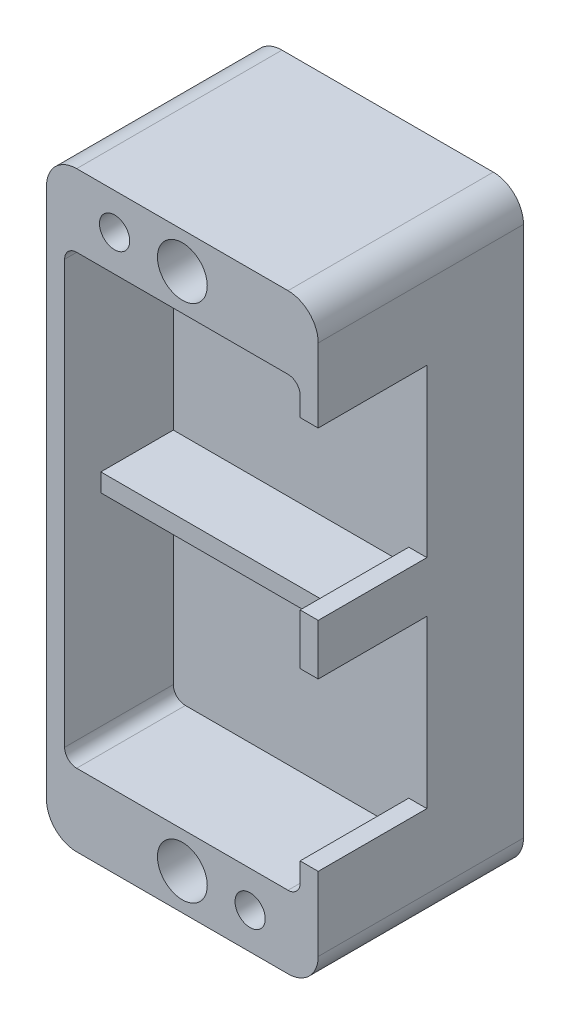
from build123d import *

# Parameters (mm, degrees)
CROQUIS1_W              = 98
CROQUIS1_H              = 45
SALIENTE_EXTRUIR1_DEPTH = 34
REDONDEO1_R             = 5
CROQUIS2_R              = 4.125
CROQUIS2_R_2            = 2.5
CORTAR_EXTRUIR1_DEPTH   = 8
CORTAR_EXTRUIR2_DEPTH   = 18
CROQUIS4_W              = 39
CROQUIS4_H              = 3
SALIENTE_EXTRUIR2_DEPTH = 12
CROQUIS5_R              = 3.54232781
CORTAR_EXTRUIR3_DEPTH   = 21


with BuildPart() as part:
    # Croquis1 → Saliente-Extruir1 (new body)
    with BuildSketch(Plane(origin=(0, 0, 0), x_dir=(0, 1, 0), z_dir=(0, 0, 1))):
        Rectangle(CROQUIS1_W, CROQUIS1_H)
    extrude(amount=SALIENTE_EXTRUIR1_DEPTH)

    # Redondeo1
    redondeo1_edges = [part.edges().sort_by_distance(p)[0] for p in [
        (22.5, 49, 17),
        (22.5, -49, 17),
        (-22.5, -49, 17),
        (-22.5, 49, 17),
    ]]
    fillet(redondeo1_edges, radius=REDONDEO1_R)

    # Croquis2 → Cortar-Extruir1 (cut)
    with BuildSketch(Plane.XY.offset(34)):
        with Locations((0, 43)):
            Circle(CROQUIS2_R)
        with Locations((0, -43)):
            Circle(CROQUIS2_R)
        with Locations((-11.225, 43)):
            Circle(CROQUIS2_R_2)
        with Locations((11.225, -43)):
            Circle(CROQUIS2_R_2)
    extrude(amount=-CORTAR_EXTRUIR1_DEPTH, mode=Mode.SUBTRACT)

    # Croquis3 → Cortar-Extruir2 (cut)
    with BuildSketch(Plane.XY.offset(34)):
        with BuildLine():
            Line((-19.5, -35), (-19.5, 35))
            ThreePointArc((-19.5, 35), (-18.914213562, 36.414213562), (-17.5, 37))
            Line((-17.5, 37), (17.5, 37))
            ThreePointArc((17.5, 37), (18.914213562, 36.414213562), (19.5, 35))
            Line((19.5, 35), (19.5, 31.792704716))
            Line((19.5, 31.792704716), (22.5, 31.792704716))
            Line((22.5, 31.792704716), (22.5, 4.207295284))
            Line((22.5, 4.207295284), (19.5, 4.207295284))
            Line((19.5, 4.207295284), (19.5, -4.207295284))
            Line((19.5, -4.207295284), (22.5, -4.207295284))
            Line((22.5, -4.207295284), (22.5, -31.792704716))
            Line((22.5, -31.792704716), (19.5, -31.792704716))
            Line((19.5, -31.792704716), (19.5, -35))
            ThreePointArc((19.5, -35), (18.914213562, -36.414213562), (17.5, -37))
            Line((17.5, -37), (-17.5, -37))
            ThreePointArc((-17.5, -37), (-18.914213562, -36.414213562), (-19.5, -35))
        make_face()
    extrude(amount=-CORTAR_EXTRUIR2_DEPTH, mode=Mode.SUBTRACT)

    # Croquis4 → Saliente-Extruir2 (add)
    with BuildSketch(Plane.XY.offset(16)):
        Rectangle(CROQUIS4_W, CROQUIS4_H)
    extrude(amount=SALIENTE_EXTRUIR2_DEPTH)

    # Croquis5 → Cortar-Extruir3 (cut)
    with BuildSketch(Plane(origin=(-22.5, 0, 0), x_dir=(0, -1, 0), z_dir=(-1, 0, 0))):
        with Locations(Location((-7.749623094, 8, 0), (0, 0, 90))):
            Circle(CROQUIS5_R)
        with Locations(Location((-18, 8, 0), (0, 0, 90))):
            Circle(CROQUIS5_R)
        with Locations(Location((-28.250376906, 8, 0), (0, 0, 90))):
            Circle(CROQUIS5_R)
        with Locations(Location((28.250376906, 8, 0), (0, 0, 270))):
            Circle(CROQUIS5_R)
        with Locations(Location((18, 8, 0), (0, 0, 270))):
            Circle(CROQUIS5_R)
        with Locations(Location((7.749623094, 8, 0), (0, 0, 270))):
            Circle(CROQUIS5_R)
    extrude(amount=-CORTAR_EXTRUIR3_DEPTH, mode=Mode.SUBTRACT)


solid = part.part
